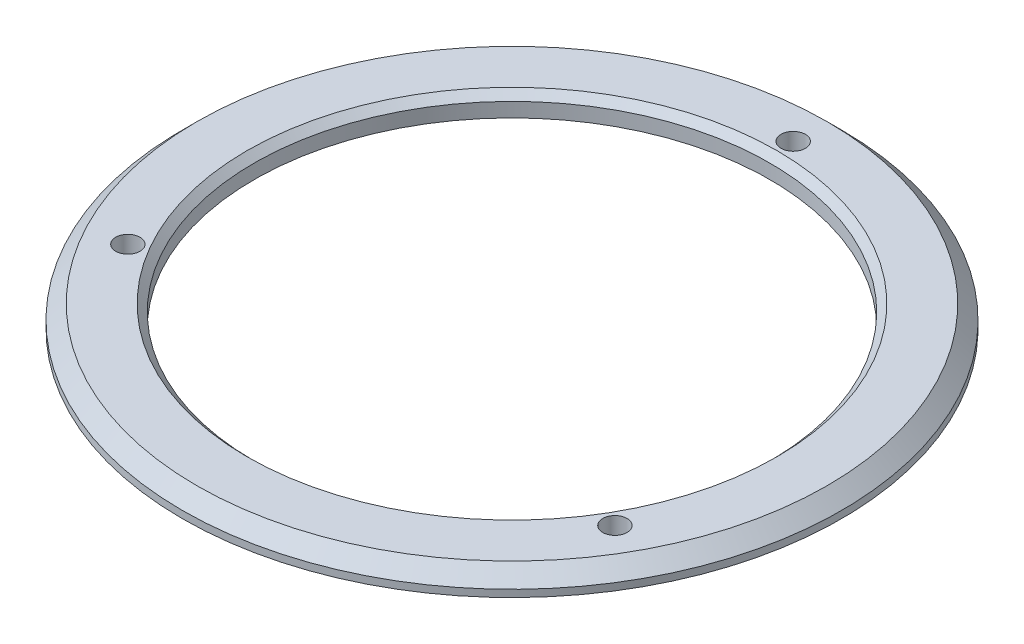
from build123d import *

# Parameters (mm, degrees)
SKETCH1_R           = 46
SKETCH1_R_2         = 36
BOSS_EXTRUDE1_DEPTH = 3
CHAMFER1_SIZE       = 2
SKETCH2_R           = 1.7
CUT_EXTRUDE1_DEPTH  = 66.122960621
CIRPATTERN1_COUNT   = 3
CHAMFER2_SIZE       = 1


with BuildPart() as part:
    # Sketch1 → Boss-Extrude1 (new body)
    with BuildSketch(Plane(origin=(0, 0, 0), x_dir=(1, 0, 0), z_dir=(0, 1, 0))):
        with Locations(Location((0, 0, 0), (0, 0, 270))):
            Circle(SKETCH1_R)
        with Locations(Location((0, 0, 0), (0, 0, 270))):
            Circle(SKETCH1_R_2, mode=Mode.SUBTRACT)
    extrude(amount=BOSS_EXTRUDE1_DEPTH)

    # Chamfer1
    chamfer1_edges = [part.edges().sort_by_distance(p)[0] for p in [
        (0, 3, -46),
    ]]
    chamfer(chamfer1_edges, length=CHAMFER1_SIZE)

    # Sketch2 → Cut-Extrude1 (cut, through all)
    with BuildSketch(Plane(origin=(0, 3, 0), x_dir=(1, 0, 0), z_dir=(0, 1, 0))):
        with Locations(Location((0, 39.251, 0), (0, 0, 270))):
            Circle(SKETCH2_R)
    cut_extrude1 = extrude(amount=-CUT_EXTRUDE1_DEPTH, mode=Mode.SUBTRACT)

    # CirPattern1: Cut-Extrude1 ×3 about axis
    cirpattern1_axis = Axis((0, 0, 0), (0, 1, 0))
    for i in range(1, CIRPATTERN1_COUNT):
        add(cut_extrude1.rotate(cirpattern1_axis, i * 360 / CIRPATTERN1_COUNT), mode=Mode.SUBTRACT)

    # Chamfer2
    chamfer2_edges = [part.edges().sort_by_distance(p)[0] for p in [
        (0, 3, -36),
    ]]
    chamfer(chamfer2_edges, length=CHAMFER2_SIZE)


solid = part.part
